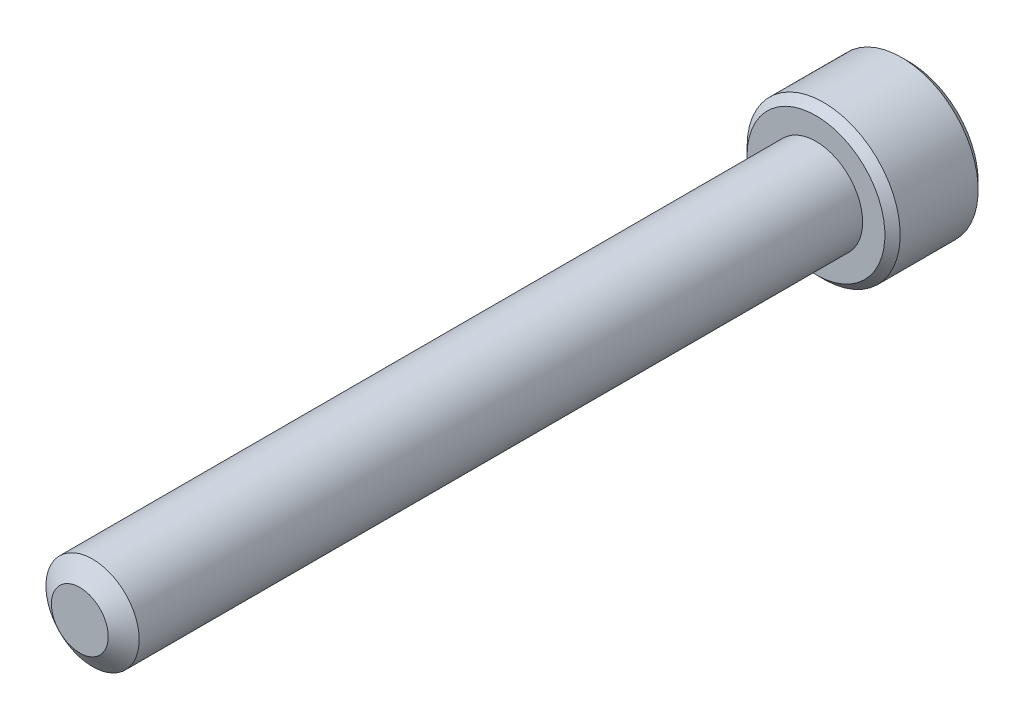
from build123d import *

# Parameters (mm, degrees)
SKETCH1_R          = 2.413
EXTRUDE1_DEPTH     = 38.1
SKETCH6_R          = 3.9624
EXTRUDE2_DEPTH     = 4.826
CUT_EXTRUDE1_DEPTH = 2.9765625
CHAMFER1_SIZE      = 0.39624


with BuildPart() as part:
    # Sketch1 → Extrude1 (new body)
    with BuildSketch(Plane.XY):
        Circle(SKETCH1_R)
    extrude(amount=-EXTRUDE1_DEPTH)

    # Sketch4 → Cut-Revolve1 (revolve, cut)
    with BuildSketch(Plane(origin=(0, 0, 0), x_dir=(0, 0, -1), z_dir=(1, 0, 0)), mode=Mode.PRIVATE) as cut_revolve1_sk:
        Polygon((0.659180743, 2.413), (0, 1.471592336), (0, 2.413), align=None)
    revolve(cut_revolve1_sk.sketch.rotate(Axis((0, 0, 0), (0, 0, -1)), 90), axis=Axis((0, 0, 0), (0, 0, -1)), mode=Mode.SUBTRACT)

    # Sketch6 → Extrude2 (add)
    with BuildSketch(Plane(origin=(0, 0, -38.1), x_dir=(-1, 0, 0), z_dir=(0, 0, -1))):
        Circle(SKETCH6_R)
    extrude(amount=EXTRUDE2_DEPTH)

    # Sketch7 → Cut-Extrude1 (cut)
    with BuildSketch(Plane(origin=(0, 0, -42.926), x_dir=(-1, 0, 0), z_dir=(0, 0, -1))):
        Polygon((0, 2.291358881), (-1.984375, 1.14567944), (-1.984375, -1.14567944), (0, -2.291358881), (1.984375, -1.14567944), (1.984375, 1.14567944), align=None)
    extrude(amount=-CUT_EXTRUDE1_DEPTH, mode=Mode.SUBTRACT)

    # Cut-Extrude2 cone 1 section (through the dimple's axis) → Cut-Extrude2 (revolve, cut)
    with BuildSketch(Plane(origin=(0, 0, -42.926), x_dir=(0, 1, 0), z_dir=(1, 0, 0))):
        Polygon((0, 0), (2.291358881, 0), (0, 2.291358881), align=None)
    revolve(axis=Axis((0, 0, -42.926), (0, 0, 1)), mode=Mode.SUBTRACT)

    # Chamfer1
    chamfer1_edges = [part.edges().sort_by_distance(p)[0] for p in [
        (3.9624, 0, -38.1),
        (3.9624, 0, -42.926),
    ]]
    chamfer(chamfer1_edges, length=CHAMFER1_SIZE)


solid = part.part
